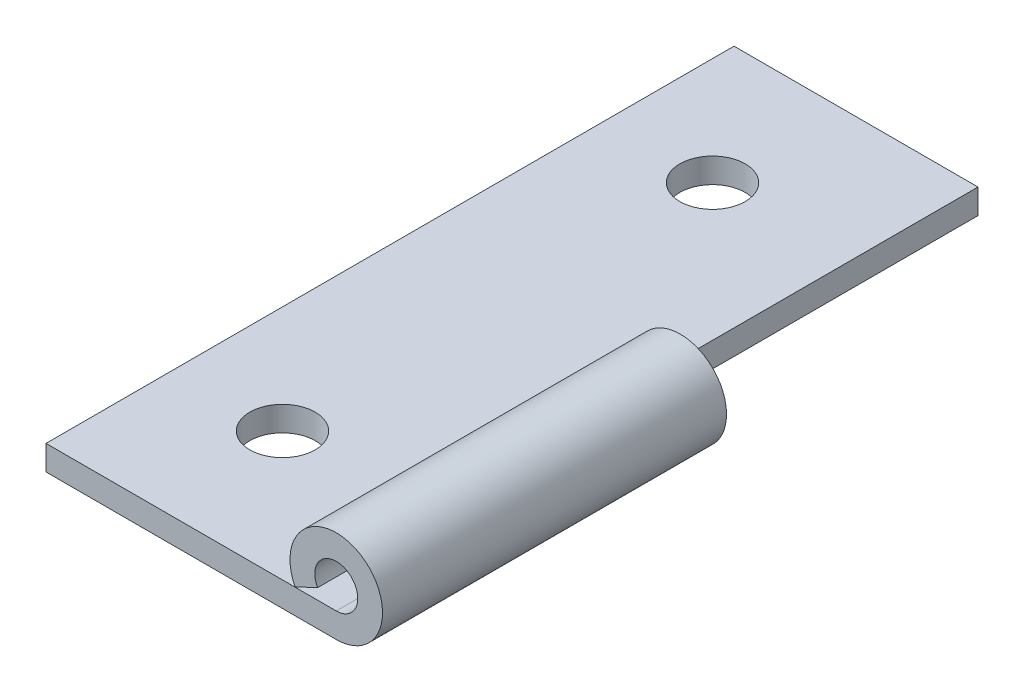
from build123d import *

# Parameters (mm, degrees)
EXTRUDE1_DEPTH                      = 50.8
SKETCH2_W                           = 6.8326
SKETCH2_H                           = 25.4
CUT_EXTRUDE6_DEPTH                  = 56.557383842
EXTRUDE2_DEPTH                      = 50.8
SKETCH4_W                           = 6.8326
SKETCH4_H                           = 25.4
CUT_EXTRUDE7_DEPTH                  = 56.557383842
SKETCH5_R                           = 1.5875
EXTRUDE3_DEPTH                      = 25.4
SKETCH12_W                          = 2.413
SKETCH12_H                          = 1.8288
F_8_0_199_DIAMETER_HOLE1_AT_2_COUNT = 2
F_8_0_199_DIAMETER_HOLE1_AT_2_PITCH = 26.9875
F_8_0_199_DIAMETER_HOLE1_AT_3_COUNT = 2
F_8_0_199_DIAMETER_HOLE1_AT_3_PITCH = 41.669985076
F_8_0_199_DIAMETER_HOLE1_AT_4_COUNT = 2
F_8_0_199_DIAMETER_HOLE1_AT_4_PITCH = 31.75


with BuildPart() as part:
    # Sketch1 → Extrude1 (new body)
    with BuildSketch(Plane.XY):
        with BuildLine():
            Line((-21.43125, 0), (0, 0))
            ThreePointArc((0, 0), (1.779677423, 6.332436821), (-3.038247732, 1.8542))
            Line((-3.038247732, 1.8542), (-1.378132955, 2.628324234))
            ThreePointArc((-1.378132955, 2.628324234), (0.796631885, 4.789447439), (0, 1.8288))
            Line((0, 1.8288), (-21.43125, 1.8288))
            Line((-21.43125, 1.8288), (-21.43125, 0))
        make_face()
    extrude(amount=EXTRUDE1_DEPTH)

    # Sketch2 → Cut-Extrude6 (cut, through all)
    with BuildSketch(Plane(origin=(0, 0, 0), x_dir=(1, 0, 0), z_dir=(0, 1, 0))):
        with Locations((0, -12.7)):
            Rectangle(SKETCH2_W, SKETCH2_H)
    extrude(amount=CUT_EXTRUDE6_DEPTH, mode=Mode.SUBTRACT)


with BuildPart() as body_2:
    # Sketch3 → Extrude2 (new body)
    with BuildSketch(Plane.XY):
        with BuildLine():
            Line((0, 0), (21.43125, 0))
            Line((21.43125, 0), (21.43125, 1.8288))
            Line((21.43125, 1.8288), (3.025053626, 1.8288))
            ThreePointArc((3.025053626, 1.8288), (-1.767445818, 6.339866481), (0, 0))
        make_face()
    extrude(amount=EXTRUDE2_DEPTH)

    # Sketch4 → Cut-Extrude7 (cut, through all)
    with BuildSketch(Plane(origin=(0, 0, 0), x_dir=(1, 0, 0), z_dir=(0, 1, 0))):
        with Locations((0, -38.1)):
            Rectangle(SKETCH4_W, SKETCH4_H)
    extrude(amount=CUT_EXTRUDE7_DEPTH, mode=Mode.SUBTRACT)


with BuildPart() as body_3:
    # Sketch5 → Extrude3 (new body)
    with BuildSketch(Plane(origin=(0, 0, 25.4), x_dir=(-1, 0, 0), z_dir=(0, 0, -1))):
        with Locations((0, 3.4163)):
            Circle(SKETCH5_R)
    extrude(amount=-EXTRUDE3_DEPTH)

    # Sketch9 → Cut-Revolve1 (revolve, cut)
    with BuildSketch(Plane(origin=(0, 3.4163, 0), x_dir=(-1, 0, 0), z_dir=(0, 1, 0)), mode=Mode.PRIVATE) as cut_revolve1_sk:
        Polygon((-0.3175, 50.8), (-1.5875, 49.53), (-1.5875, 50.8), align=None)
    revolve(cut_revolve1_sk.sketch.rotate(Axis((0, 3.4163, 25.4), (0, 0, -1)), 180), axis=Axis((0, 3.4163, 25.4), (0, 0, -1)), mode=Mode.SUBTRACT)


with BuildPart() as body_2_1:
    add(body_2.part)

    # Combine1: union body 3
    add(body_3.part)

    # Sketch12 → #8 (0.199) Diameter Hole1 (revolve, cut)
    with BuildSketch(Plane(origin=(13.49375, 1.8288, 9.525), x_dir=(0, 0, 1), z_dir=(1, 0, 0))):
        with Locations((1.2065, 0.9144)):
            Rectangle(SKETCH12_W, SKETCH12_H)
    f_8_0_199_diameter_hole1 = revolve(axis=Axis((13.49375, 8.1788, 9.525), (0, -1, 0)), mode=Mode.SUBTRACT)

    # #8 (0.199) Diameter Hole1 at 4: #8 (0.199) Diameter Hole1 ×2
    with Locations(*[(0, 0, i * F_8_0_199_DIAMETER_HOLE1_AT_4_PITCH) for i in range(1, F_8_0_199_DIAMETER_HOLE1_AT_4_COUNT)]):
        add(f_8_0_199_diameter_hole1, mode=Mode.SUBTRACT)


with BuildPart() as part_1:
    add(part.part)

    # #8 (0.199) Diameter Hole1 at 2: #8 (0.199) Diameter Hole1 ×2
    with Locations(*[(-i * F_8_0_199_DIAMETER_HOLE1_AT_2_PITCH, 0, 0) for i in range(1, F_8_0_199_DIAMETER_HOLE1_AT_2_COUNT)]):
        add(f_8_0_199_diameter_hole1, mode=Mode.SUBTRACT)

    # #8 (0.199) Diameter Hole1 at 3: #8 (0.199) Diameter Hole1 ×2
    with Locations(*[Vector(-0.6476484200955402, 0, 0.7619393177594594) * (i * F_8_0_199_DIAMETER_HOLE1_AT_3_PITCH) for i in range(1, F_8_0_199_DIAMETER_HOLE1_AT_3_COUNT)]):
        add(f_8_0_199_diameter_hole1, mode=Mode.SUBTRACT)


solid = part_1.part
